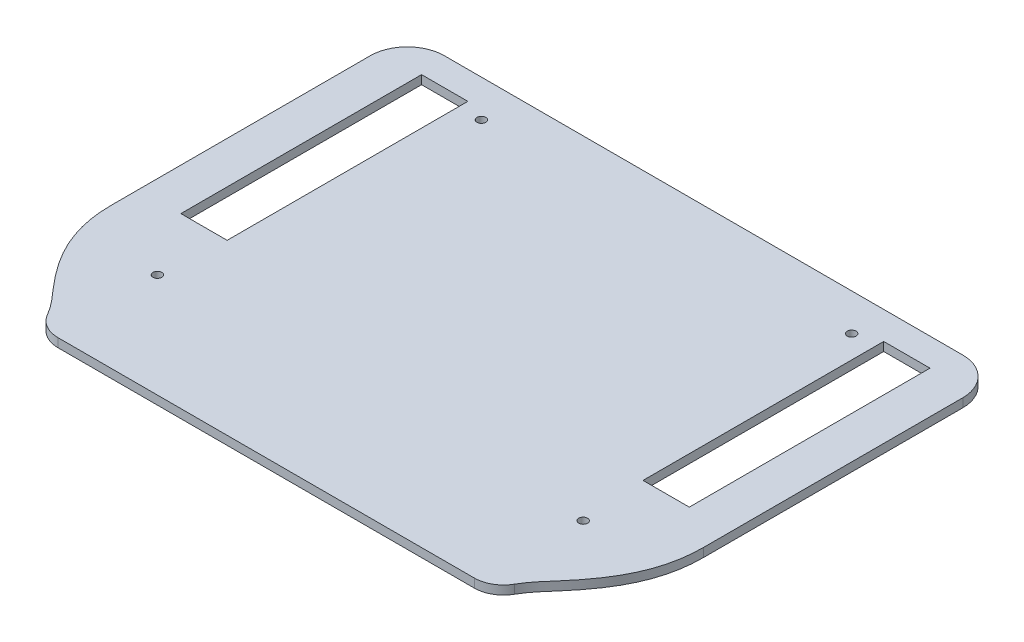
from build123d import *

# Parameters (mm, degrees)
SKETCH1_W           = 203.2
SKETCH1_H           = 150
BOSS_EXTRUDE1_DEPTH = 1.5
FILLET1_R           = 12.7
SKETCH3_R           = 1.5
SKETCH3_W           = 15.875
SKETCH3_H           = 82.55
CUT_EXTRUDE2_DEPTH  = 127.319278022
CUT_EXTRUDE3_DEPTH  = 127.319278022
FILLET2_R           = 10


with BuildPart() as part:
    # Sketch1 → Boss-Extrude1 (new, symmetric)
    with BuildSketch(Plane(origin=(0, 0, 0), x_dir=(1, 0, 0), z_dir=(0, 1, 0))):
        Rectangle(SKETCH1_W, SKETCH1_H)
    extrude(amount=BOSS_EXTRUDE1_DEPTH, both=True)

    # Fillet1
    fillet1_edges = [part.edges().sort_by_distance(p)[0] for p in [
        (-101.6, 0, 75),
        (101.6, 0, 75),
        (101.6, 0, -75),
        (-101.6, 0, -75),
    ]]
    fillet(fillet1_edges, radius=FILLET1_R)

    # Sketch3 → Cut-Extrude2 (cut, through all)
    with BuildSketch(Plane.XZ.offset(1.5)):
        with Locations(Location((63.499999999, -62.3, 0), (0, 0, 270))):
            Circle(SKETCH3_R)
        with Locations(Location((73.024999999, 39.3, 0), (0, 0, 270))):
            Circle(SKETCH3_R)
        with Locations((79.25, -24.2)):
            Rectangle(SKETCH3_W, SKETCH3_H)
    cut_extrude2 = extrude(amount=-CUT_EXTRUDE2_DEPTH, mode=Mode.SUBTRACT)

    # Sketch4 → Cut-Extrude3 (cut, through all)
    with BuildSketch(Plane.XZ.offset(1.5)):
        with BuildLine():
            Line((101.6, 62.3), (101.6, 26.6))
            add(Edge.make_bspline(
                [(77.685809709, 75), (78.616134987, 72.645348103), (81.082482683, 67.616391475), (92.836364207, 54.857655975), (101.6, 41.84), (101.6, 26.6)],
                knots=[0.409925354, 0.409925354, 0.409925354, 0.409925354, 0.484619997, 0.584619997, 1, 1, 1, 1], degree=3))
            Line((77.685809709, 75), (88.9, 75))
            ThreePointArc((88.9, 75), (97.880256121, 71.280256121), (101.6, 62.3))
        make_face()
    cut_extrude3 = extrude(amount=-CUT_EXTRUDE3_DEPTH, mode=Mode.SUBTRACT)

    # Mirror1: Cut-Extrude2, Cut-Extrude3 across plane
    add(cut_extrude2.mirror(Plane(origin=(0, 0, 0), x_dir=(0, 0, 1), z_dir=(1, 0, 0))), mode=Mode.SUBTRACT)
    add(cut_extrude3.mirror(Plane(origin=(0, 0, 0), x_dir=(0, 0, 1), z_dir=(1, 0, 0))), mode=Mode.SUBTRACT)

    # Fillet2
    fillet2_edges = [part.edges().sort_by_distance(p)[0] for p in [
        (77.685809709, 0, 75),
        (-77.685809709, 0, 75),
    ]]
    fillet(fillet2_edges, radius=FILLET2_R)


solid = part.part
